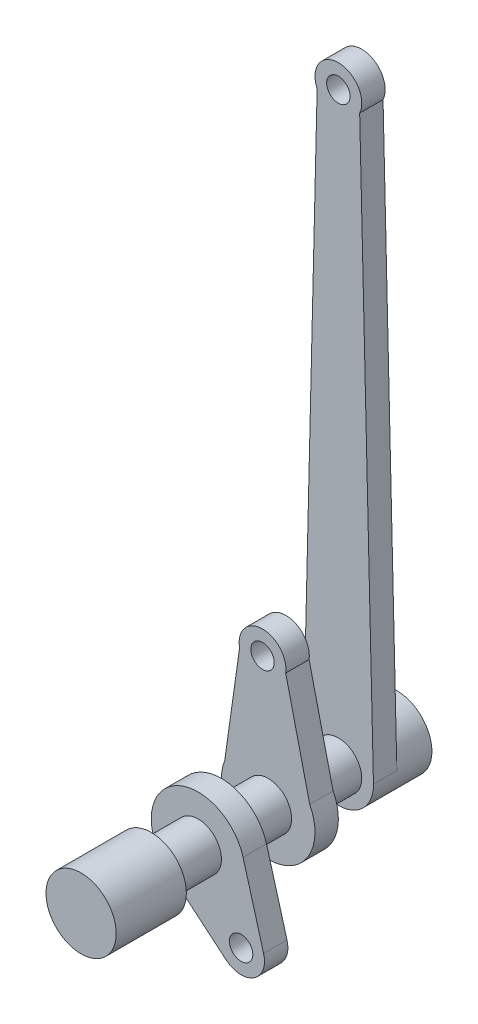
from build123d import *

# Parameters (mm, degrees)
ESBO_O1_R                  = 15
RESSALTO_EXTRUS_O1_DEPTH   = 15
RESSALTO_EXTRUS_O2_DEPTH   = 10
ESBO_O4_R                  = 10
RESSALTO_EXTRUS_O3_DEPTH   = 20
CORTE_EXTRUS_O3_DEPTH      = 262.629509039
CORTE_EXTRUS_O3_DEPTH_BACK = 262.629509039
ESBO_O9_R                  = 5
RESSALTO_EXTRUS_O6_DEPTH   = 10
CORTE_EXTRUS_O4_DEPTH      = 267.505159425
CORTE_EXTRUS_O4_DEPTH_BACK = 10
ESBO_O12_R                 = 5
ESBO_O13_R                 = 10
RESSALTO_EXTRUS_O7_DEPTH   = 20
ESBO_O14_R                 = 5
RESSALTO_EXTRUS_O8_DEPTH   = 10
ESBO_O15_R                 = 10
RESSALTO_EXTRUS_O9_DEPTH   = 20
ESBO_O17_R                 = 15
RESSALTO_EXTRUS_O10_DEPTH  = 30


with BuildPart() as part:
    # Esboço1 → Ressalto-extrusão1 (new body)
    with BuildSketch(Plane.XY):
        Circle(ESBO_O1_R)
    extrude(amount=RESSALTO_EXTRUS_O1_DEPTH)

    # Esboço2 → Ressalto-extrusão2 (add)
    with BuildSketch(Plane.XY.offset(15)):
        with BuildLine():
            Line((-9.078599197, 245.807263828), (-14.995643171, 0.361505045))
            ThreePointArc((-14.995643171, 0.361505045), (-0.00084936, -14.999999976), (14.995684014, 0.359806815))
            Line((14.995684014, 0.359806815), (9.105027046, 245.864968865))
            ThreePointArc((9.105027046, 245.864968865), (-0.031734455, 259.999949646), (-9.078599197, 245.807263828))
        make_face()
    extrude(amount=RESSALTO_EXTRUS_O2_DEPTH)

    # Esboço4 → Ressalto-extrusão3 (add)
    with BuildSketch(Plane.XY.offset(25)):
        Circle(ESBO_O4_R)
    extrude(amount=RESSALTO_EXTRUS_O3_DEPTH)

    # Esboço9 → Corte-extrusão3 (cut, two sides: drawn at the far end of the back side and taken through both)
    with BuildSketch(Plane.XY.offset(25).offset(-CORTE_EXTRUS_O3_DEPTH_BACK)):
        with Locations((0, 250)):
            Circle(ESBO_O9_R)
    extrude(amount=CORTE_EXTRUS_O3_DEPTH + CORTE_EXTRUS_O3_DEPTH_BACK, mode=Mode.SUBTRACT)

    # Esboço11 → Ressalto-extrusão6 (add)
    with BuildSketch(Plane(origin=(0, 0, 45), x_dir=(0.999001995685138, 0.044665564108286114, 0), z_dir=(0, 0, 1))):
        with BuildLine():
            Line((-9.890512739, 52.704277206), (-18.232895862, 8.219580797))
            ThreePointArc((-18.232895862, 8.219580797), (0.107287246, -19.999712234), (18.143662158, 8.414720642))
            Line((18.143662158, 8.414720642), (9.830225014, 52.345149552))
            ThreePointArc((9.830225014, 52.345149552), (0.182076414, 64.178342272), (-9.890512739, 52.704277206))
        make_face()
    extrude(amount=RESSALTO_EXTRUS_O6_DEPTH)

    # Esboço12 → Corte-extrusão4 (cut, two sides: drawn at the far end of the back side and taken through both)
    with BuildSketch(Plane.XY.offset(55).offset(-CORTE_EXTRUS_O4_DEPTH_BACK)):
        with Locations(Location((-2.419980263, 54.125928126, 0), (0, 0, 180))):
            Circle(ESBO_O12_R)
    extrude(amount=CORTE_EXTRUS_O4_DEPTH + CORTE_EXTRUS_O4_DEPTH_BACK, mode=Mode.SUBTRACT)

    # Esboço13 → Ressalto-extrusão7 (add)
    with BuildSketch(Plane.XY.offset(55)):
        Circle(ESBO_O13_R)
    extrude(amount=RESSALTO_EXTRUS_O7_DEPTH)

    # Esboço14 → Ressalto-extrusão8 (add)
    with BuildSketch(Plane(origin=(0, 0, 75), x_dir=(-0.8401882150112437, -0.5422949044166098, 0), z_dir=(0, 0, 1))):
        with BuildLine():
            Line((-9.556625494, 36.904640754), (-19.113250988, 5.889281508))
            ThreePointArc((-19.113250988, 5.889281508), (0, -20), (19.113250988, 5.889281508))
            Line((19.113250988, 5.889281508), (9.556625494, 36.904640754))
            ThreePointArc((9.556625494, 36.904640754), (0, 43.96), (-9.556625494, 36.904640754))
        make_face()
        with Locations(Location((0, 33.96, 0), (0, 0, 147.16))):
            Circle(ESBO_O14_R, mode=Mode.SUBTRACT)
    extrude(amount=RESSALTO_EXTRUS_O8_DEPTH)

    # Esboço15 → Ressalto-extrusão9 (add)
    with BuildSketch(Plane.XY.offset(85)):
        Circle(ESBO_O15_R)
    extrude(amount=RESSALTO_EXTRUS_O9_DEPTH)

    # Esboço17 → Ressalto-extrusão10 (add)
    with BuildSketch(Plane.XY.offset(105)):
        with Locations(Location((0, 0, 0), (0, 0, 178.619018737))):
            Circle(ESBO_O17_R)
    extrude(amount=RESSALTO_EXTRUS_O10_DEPTH)


solid = part.part
